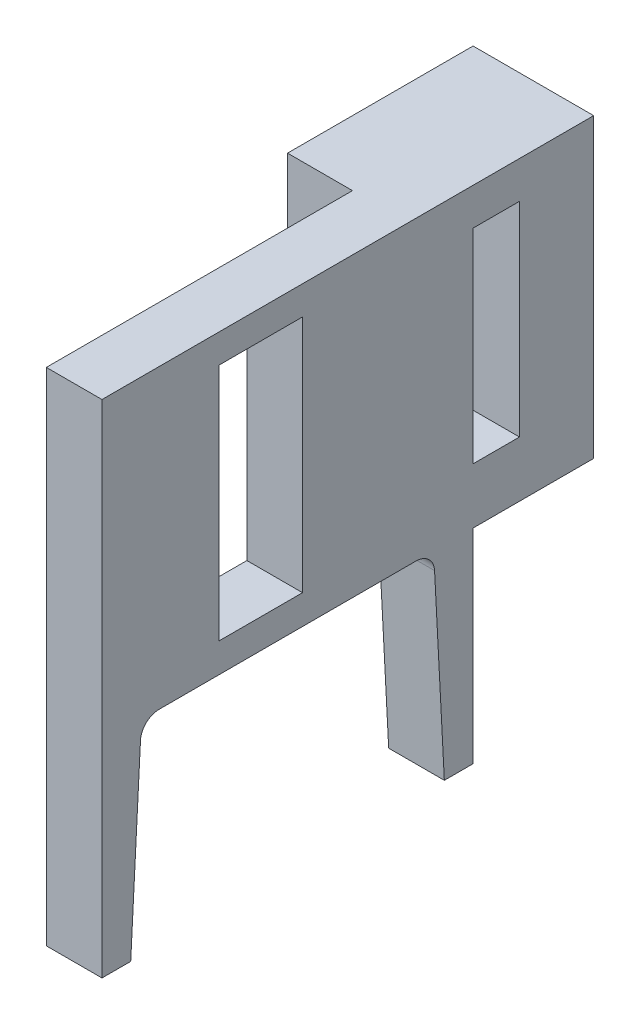
from build123d import *

# Parameters (mm, degrees)
SKETCH1_W           = 53
SKETCH1_H           = 32
BOSS_EXTRUDE1_DEPTH = 13
SKETCH7_W           = 7
SKETCH7_H           = 40
CUT_EXTRUDE3_DEPTH  = 44.534469102
SKETCH8_W           = 6
SKETCH8_H           = 40
BOSS_EXTRUDE2_DEPTH = 22
SKETCH20_W          = 6
SKETCH20_H          = 31.5
CUT_EXTRUDE9_DEPTH  = 44.534469102
CUT_EXTRUDE9_DRAFT  = -3
FILLET1_R           = 2
FILLET2_R           = 2
SKETCH49_W          = 7
SKETCH49_H          = 32
BOSS_EXTRUDE3_DEPTH = 7
SKETCH50_W          = 7
SKETCH50_H          = 20
CUT_EXTRUDE19_DEPTH = 3
SKETCH35_W          = 9
SKETCH35_H          = 25.742086546
CUT_EXTRUDE15_DEPTH = 47.853495067
SKETCH36_W          = 8.51187264
SKETCH36_H          = 25.698199293
CUT_EXTRUDE16_DEPTH = 5
SKETCH55_W          = 8.650111134
SKETCH55_H          = 26.010357873
CUT_EXTRUDE20_DEPTH = 5
SKETCH63_W          = 5
SKETCH63_H          = 22
CUT_EXTRUDE21_DEPTH = 49.117044797


with BuildPart() as part:
    # Sketch1 → Boss-Extrude1 (new body)
    with BuildSketch(Plane(origin=(0, 0, 0), x_dir=(0, 0, -1), z_dir=(1, 0, 0))):
        Rectangle(SKETCH1_W, SKETCH1_H)
    extrude(amount=BOSS_EXTRUDE1_DEPTH)

    # Sketch7 → Cut-Extrude3 (cut, through all)
    with BuildSketch(Plane(origin=(0, 16, 0), x_dir=(1, 0, 0), z_dir=(0, 1, 0))):
        with Locations((3.5, 6.5)):
            Rectangle(SKETCH7_W, SKETCH7_H)
    extrude(amount=-CUT_EXTRUDE3_DEPTH, mode=Mode.SUBTRACT)

    # Sketch8 → Boss-Extrude2 (add)
    with BuildSketch(Plane.XZ.offset(16)):
        with Locations((10, -6.5)):
            Rectangle(SKETCH8_W, SKETCH8_H)
    extrude(amount=BOSS_EXTRUDE2_DEPTH)


with BuildPart() as cut_extrude9_tool:
    # Sketch20 → Cut-Extrude9 (with draft: the straight prism first)
    with BuildSketch(Plane(origin=(0, -16, 0), x_dir=(-1, 0, 0), z_dir=(0, -1, 0))):
        with Locations((-10, 6.5)):
            Rectangle(SKETCH20_W, SKETCH20_H)
    extrude(amount=CUT_EXTRUDE9_DEPTH)
    # Cut-Extrude9: the draft: its side faces are tilted about the plane it starts from
    cut_extrude9_sides = [cut_extrude9_tool.faces().sort_by_distance(p)[0] for p in [
        (10, -38.267234551, 9.25),
        (7, -38.267234551, -6.5),
        (10, -38.267234551, -22.25),
        (13, -38.267234551, -6.5),
    ]]
    draft(cut_extrude9_sides, Plane(origin=(0, -16, 0), x_dir=(-1, 0, 0), z_dir=(0, -1, 0)), CUT_EXTRUDE9_DRAFT)


with BuildPart() as part_1:
    add(part.part)

    # Cut-Extrude9: cut by cut_extrude9_tool
    add(cut_extrude9_tool.part, mode=Mode.SUBTRACT)

    # Fillet1
    fillet1_edges = [part_1.edges().sort_by_distance(p)[0] for p in [
        (10, -16, -22.25),
    ]]
    fillet(fillet1_edges, radius=FILLET1_R)

    # Fillet2
    fillet2_edges = [part_1.edges().sort_by_distance(p)[0] for p in [
        (10, -16, 9.25),
    ]]
    fillet(fillet2_edges, radius=FILLET2_R)

    # Sketch49 → Boss-Extrude3 (add)
    with BuildSketch(Plane(origin=(0, 0, 13.5), x_dir=(-1, 0, 0), z_dir=(0, 0, -1))):
        with Locations((-3.5, 0)):
            Rectangle(SKETCH49_W, SKETCH49_H)
    extrude(amount=BOSS_EXTRUDE3_DEPTH)

    # Sketch50 → Cut-Extrude19 (cut)
    with BuildSketch(Plane.XZ.offset(16)):
        with Locations((3.5, 16.5)):
            Rectangle(SKETCH50_W, SKETCH50_H)
    extrude(amount=-CUT_EXTRUDE19_DEPTH, mode=Mode.SUBTRACT)

    # Sketch35 → Cut-Extrude15 (cut, through all)
    with BuildSketch(Plane.ZY.offset(-7)):
        with Locations((-9.381446742, 0.030527838)):
            Rectangle(SKETCH35_W, SKETCH35_H)
    extrude(amount=-CUT_EXTRUDE15_DEPTH, mode=Mode.SUBTRACT)

    # Sketch36 → Cut-Extrude16 (cut)
    with BuildSketch(Plane.ZY.offset(-7)):
        with Locations((0.636992311, -0.150900353)):
            Rectangle(SKETCH36_W, SKETCH36_H)
    extrude(amount=-CUT_EXTRUDE16_DEPTH, mode=Mode.SUBTRACT)

    # Sketch55 → Cut-Extrude20 (cut)
    with BuildSketch(Plane.ZY.offset(-7)):
        with Locations((-20.206502309, -0.103607826)):
            Rectangle(SKETCH55_W, SKETCH55_H)
    extrude(amount=-CUT_EXTRUDE20_DEPTH, mode=Mode.SUBTRACT)

    # Sketch63 → Cut-Extrude21 (cut, through all)
    with BuildSketch(Plane.ZY):
        with Locations((16, 1)):
            Rectangle(SKETCH63_W, SKETCH63_H)
    extrude(amount=-CUT_EXTRUDE21_DEPTH, mode=Mode.SUBTRACT)


with BuildPart() as body_2:
    # Mirror1: mirrored copy
    add(part_1.part.mirror(Plane(origin=(13, 16, 26.5), x_dir=(1, 0, 0), z_dir=(0, 0, -1))))


solid = body_2.part
